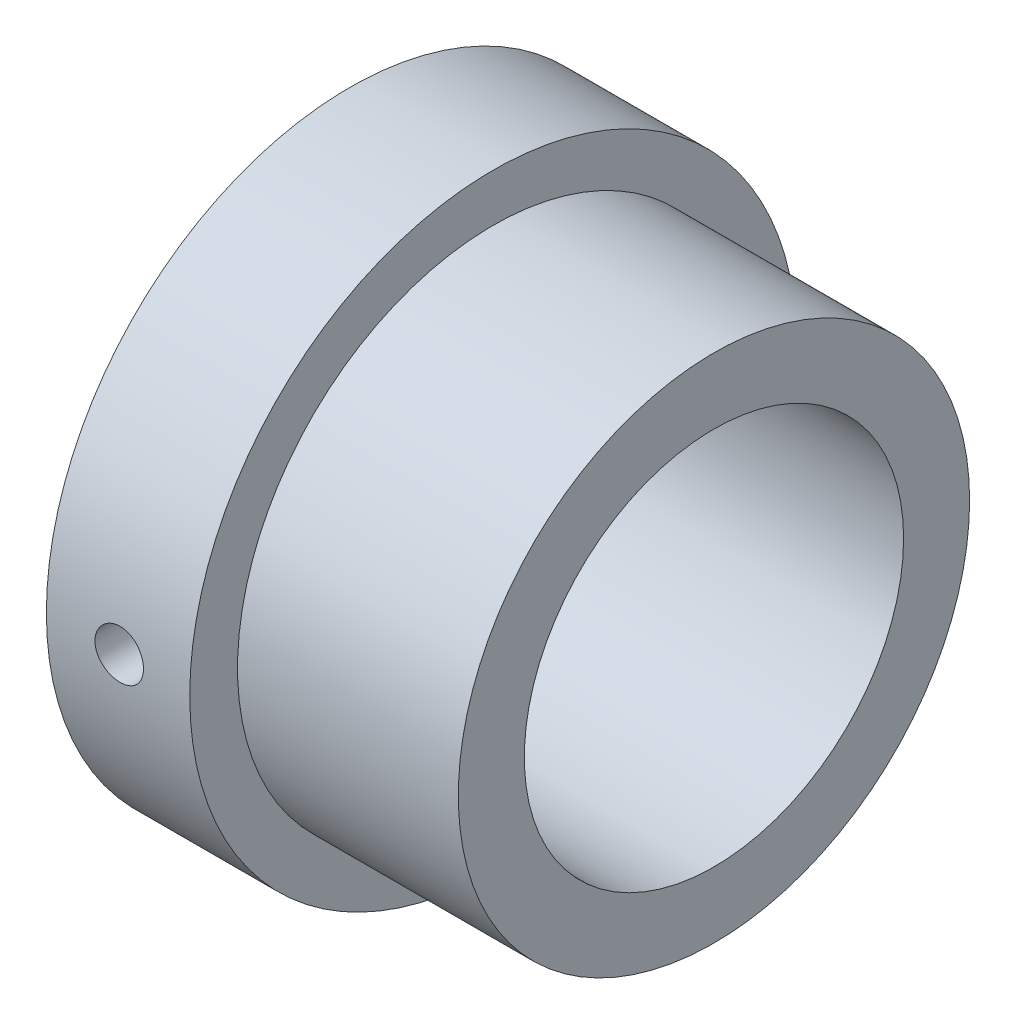
from build123d import *

# Parameters (mm, degrees)
SKETCH1_R                       = 6.35
SKETCH1_R_2                     = 3.96875
BOSS_EXTRUDE1_DEPTH             = 7.62
SKETCH2_W                       = 4.62
SKETCH2_H                       = 1
F_1_32_0_03125_DIAMETER_HOLE1_D = 0.79375


with BuildPart() as part:
    # Sketch1 → Boss-Extrude1 (new body)
    with BuildSketch(Plane(origin=(0, 0, 0), x_dir=(0, 0, -1), z_dir=(1, 0, 0))):
        with Locations(Location((0, 0, 0), (0, 0, 180))):
            Circle(SKETCH1_R)
        with Locations(Location((0, 0, 0), (0, 0, 180))):
            Circle(SKETCH1_R_2, mode=Mode.SUBTRACT)
    extrude(amount=BOSS_EXTRUDE1_DEPTH)

    # Sketch2 → Cut-Revolve1 (revolve, cut)
    with BuildSketch(Plane.XY, mode=Mode.PRIVATE) as cut_revolve1_sk:
        with Locations((5.31, 5.85)):
            Rectangle(SKETCH2_W, SKETCH2_H)
    revolve(cut_revolve1_sk.sketch.rotate(Axis((7.62, 0, 0), (-1, 0, 0)), 270), axis=Axis((7.62, 0, 0), (-1, 0, 0)), mode=Mode.SUBTRACT)

    # Sketch3 → #60 (0.04) Diameter Hole1 (revolve, cut)
    with BuildSketch(Plane.YZ.offset(1.524)):
        Polygon((0, 0), (0, 25.705237194), (0.508, 25.4), (0.508, 0), align=None)
    revolve(axis=Axis((1.524, 0, -6.35), (0, 0, 1)), mode=Mode.SUBTRACT)

    # 1/32 (0.03125) Diameter Hole1 (through all)
    with Locations(Plane(origin=(0, 0, -5.08), x_dir=(1, 0, 0), z_dir=(0, 0, -1))):
        with Locations((1.524, 5.08)):
            Hole(F_1_32_0_03125_DIAMETER_HOLE1_D / 2)


solid = part.part
